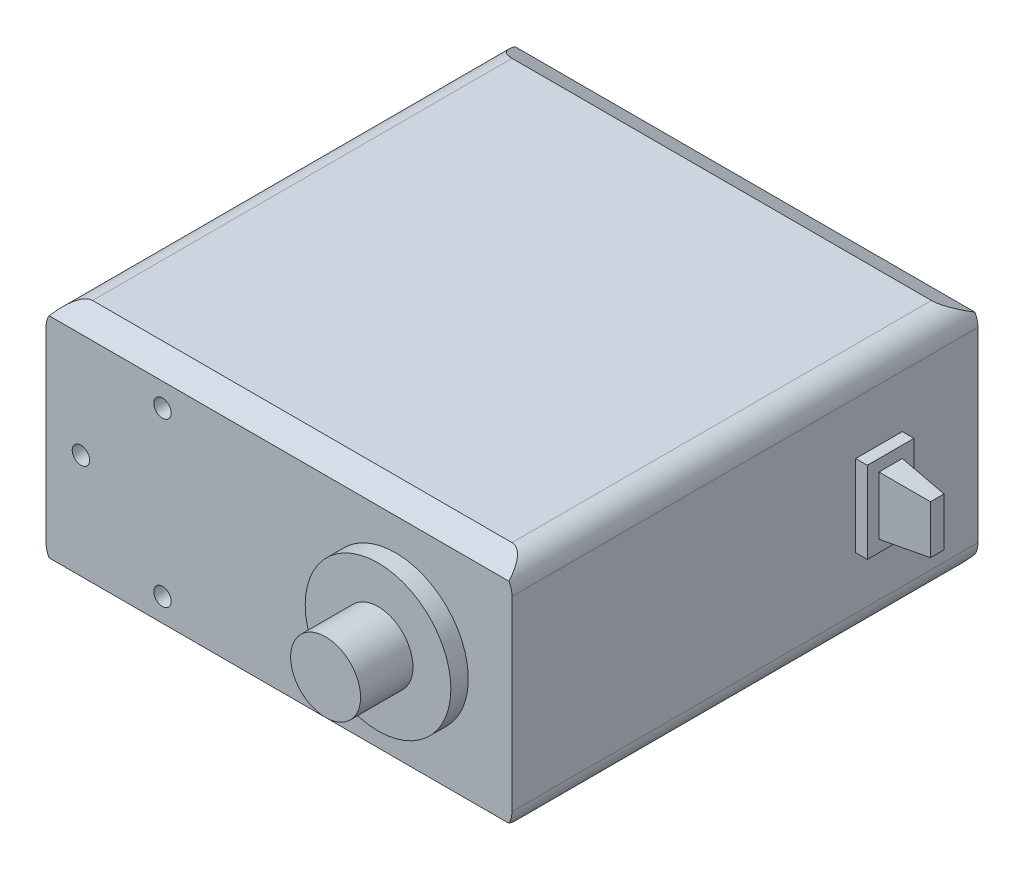
from build123d import *

# Parameters (mm, degrees)
SKETCH_1_W          = 40
SKETCH_1_H          = 40
EXTRUDE_1_DEPTH     = 20
SKETCH_2_R          = 6.25
EXTRUDE_2_DEPTH     = 1.5
SKETCH_3_R          = 3
EXTRUDE_776_DEPTH   = 4.5
EXTRUDE_START       = 1.5
SKETCH_4_R          = 6.25
EXTRUDE_4_DEPTH     = 1.5
EXTRUDE_START_2     = 3.7
SKETCH_5_R          = 3
EXTRUDE_5_DEPTH     = 3.7
SKETCH_7_R          = 0.75
CUT_EXTRUDE_1_DEPTH = 5
SKETCH_8_R          = 0.75
CUT_EXTRUDE_2_DEPTH = 5
EXTRUDE_6_DEPTH     = 1
EXTRUDE_1947_DEPTH  = 4
EXTRUDE_1947_TAPER  = 6
CUT_EXTRUDE_3_DEPTH = 65.156059729
FILLET_1_R          = 2


with BuildPart() as part:
    # Эскиз1 → Бобышка-Вытянуть1 (new body)
    with BuildSketch(Plane(origin=(0, 0, 0), x_dir=(1, 0, 0), z_dir=(0, 1, 0))):
        with Locations((20, -20)):
            Rectangle(SKETCH_1_W, SKETCH_1_H)
    extrude(amount=EXTRUDE_1_DEPTH)

    # Эскиз2 → Бобышка-Вытянуть2 (add)
    with BuildSketch(Plane.XY.offset(40)):
        with Locations(Location((30, 10, 0), (0, 0, 180))):
            Circle(SKETCH_2_R)
    extrude(amount=EXTRUDE_2_DEPTH)

    # Эскиз3 → Extrude 776 (add)
    with BuildSketch(Plane.XY.offset(41.5)):
        with Locations((30, 10)):
            Circle(SKETCH_3_R)
    extrude(amount=EXTRUDE_776_DEPTH)

    # Эскиз4 → Бобышка-Вытянуть4 (add)
    with BuildSketch(Plane(origin=(0, 0, 0), x_dir=(-1, 0, 0), z_dir=(0, 0, -1)).offset(EXTRUDE_START)):
        with Locations((-30, 10)):
            Circle(SKETCH_4_R)
    extrude(amount=-EXTRUDE_4_DEPTH)

    # Эскиз5 → Бобышка-Вытянуть5 (add)
    with BuildSketch(Plane(origin=(0, 0, -1.5), x_dir=(-1, 0, 0), z_dir=(0, 0, -1)).offset(EXTRUDE_START_2)):
        with Locations(Location((-30, 10, 0), (0, 0, 180))):
            Circle(SKETCH_5_R)
    extrude(amount=-EXTRUDE_5_DEPTH)

    # Эскиз7 → Вырез-Вытянуть1 (cut)
    with BuildSketch(Plane(origin=(0, 0, 0), x_dir=(-1, 0, 0), z_dir=(0, 0, -1))):
        with Locations((-17.5, 17.5)):
            Circle(SKETCH_7_R)
        with Locations((-2.5, 17.5)):
            Circle(SKETCH_7_R)
        with Locations((-2.5, 2.5)):
            Circle(SKETCH_7_R)
        with Locations((-17.5, 2.5)):
            Circle(SKETCH_7_R)
    extrude(amount=-CUT_EXTRUDE_1_DEPTH, mode=Mode.SUBTRACT)

    # Эскиз8 → Вырез-Вытянуть2 (cut)
    with BuildSketch(Plane.XY.offset(40)):
        with Locations((10, 17)):
            Circle(SKETCH_8_R)
        with Locations((3, 10)):
            Circle(SKETCH_8_R)
        with Locations((10, 3)):
            Circle(SKETCH_8_R)
    extrude(amount=-CUT_EXTRUDE_2_DEPTH, mode=Mode.SUBTRACT)

    # Эскиз9 → Бобышка-Вытянуть6 (add)
    with BuildSketch(Plane(origin=(40, 0, 0), x_dir=(0, 0, -1), z_dir=(1, 0, 0))):
        Polygon((-6.5, 10), (-6.5, 13.5), (-10.5, 13.5), (-10.5, 6.5), (-6.5, 6.5), align=None)
    extrude(amount=EXTRUDE_6_DEPTH)

    # Эскиз10 → Extrude 1947 (add)
    with BuildSketch(Plane(origin=(41, 0, 0), x_dir=(0, 0, -1), z_dir=(1, 0, 0))):
        Polygon((-7.5, 12.5), (-8.5, 12.5), (-9.5, 12.5), (-9.5, 7.5), (-7.5, 7.5), align=None)
    extrude(amount=EXTRUDE_1947_DEPTH, taper=EXTRUDE_1947_TAPER)

    # Эскиз11 → Вырез-Вытянуть3 (cut, through all)
    with BuildSketch(Plane(origin=(40, 0, 0), x_dir=(0, 0, -1), z_dir=(1, 0, 0))):
        Polygon((-40, 20), (-38, 20), (-40, 19), align=None)
        Polygon((0, 20), (-2, 20), (0, 19), align=None)
        Polygon((0, 0), (-2, 0), (0, 1), align=None)
        Polygon((-40, 0), (-38, 0), (-40, 1), align=None)
    extrude(amount=-CUT_EXTRUDE_3_DEPTH, mode=Mode.SUBTRACT)

    # Скругление1
    fillet_1_edges = [part.edges().sort_by_distance(p)[0] for p in [
        (0, 0, 20),
        (0, 20, 20),
        (40, 0, 20),
        (40, 20, 20),
    ]]
    fillet(fillet_1_edges, radius=FILLET_1_R)


solid = part.part
